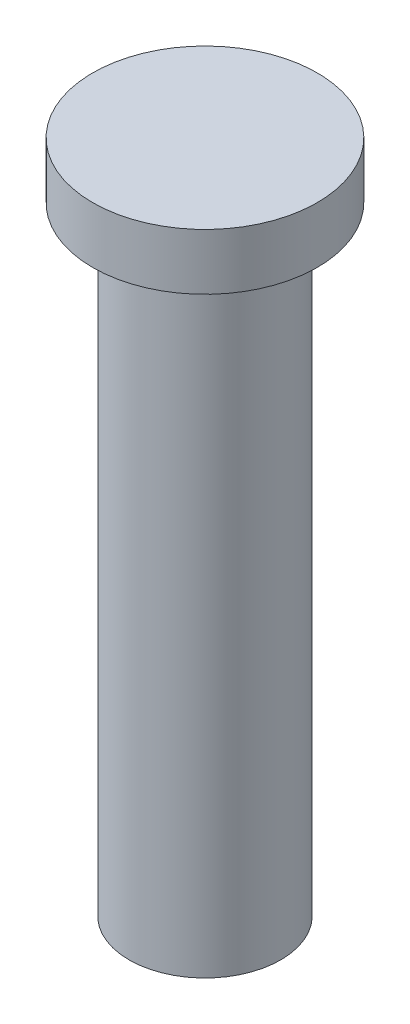
from build123d import *

# Parameters (mm, degrees)
SKETCH1_R           = 1.35
BOSS_EXTRUDE1_DEPTH = 11
SKETCH2_R           = 2
BOSS_EXTRUDE2_DEPTH = 1


with BuildPart() as part:
    # Sketch1 → Boss-Extrude1 (new body)
    with BuildSketch(Plane(origin=(0, 0, 0), x_dir=(1, 0, 0), z_dir=(0, 1, 0))):
        with Locations(Location((0, 0, 0), (0, 0, 270))):
            Circle(SKETCH1_R)
    extrude(amount=BOSS_EXTRUDE1_DEPTH)

    # Sketch2 → Boss-Extrude2 (add)
    with BuildSketch(Plane(origin=(0, 11, 0), x_dir=(1, 0, 0), z_dir=(0, 1, 0))):
        with Locations(Location((0, 0, 0), (0, 0, 270))):
            Circle(SKETCH2_R)
    extrude(amount=BOSS_EXTRUDE2_DEPTH)


solid = part.part
